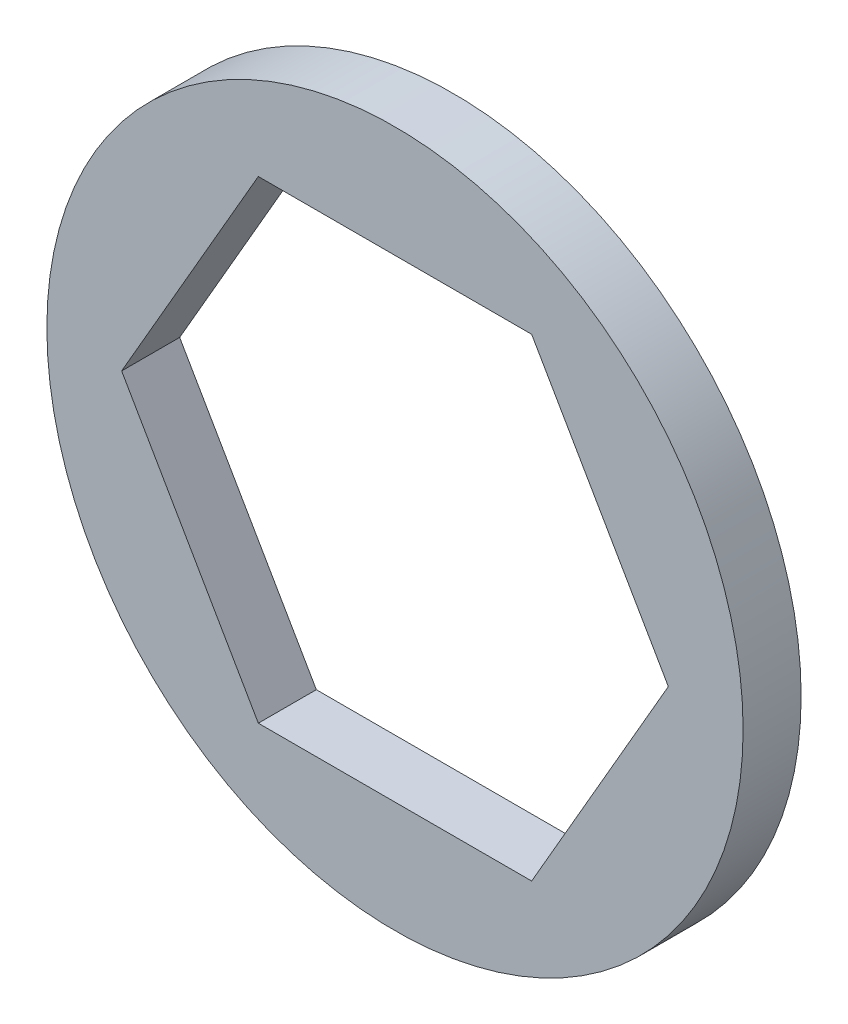
from build123d import *

# Parameters (mm, degrees)
SKETCH1_R           = 9.525
BOSS_EXTRUDE1_DEPTH = 0.79375


with BuildPart() as part:
    # Sketch1 → Boss-Extrude1 (new, symmetric)
    with BuildSketch(Plane.XY):
        Circle(SKETCH1_R)
        Polygon((7.478995387, 0), (3.739497694, 6.477), (-3.739497694, 6.477), (-7.478995387, 0), (-3.739497694, -6.477), (3.739497694, -6.477), align=None, mode=Mode.SUBTRACT)
    extrude(amount=BOSS_EXTRUDE1_DEPTH, both=True)


solid = part.part
